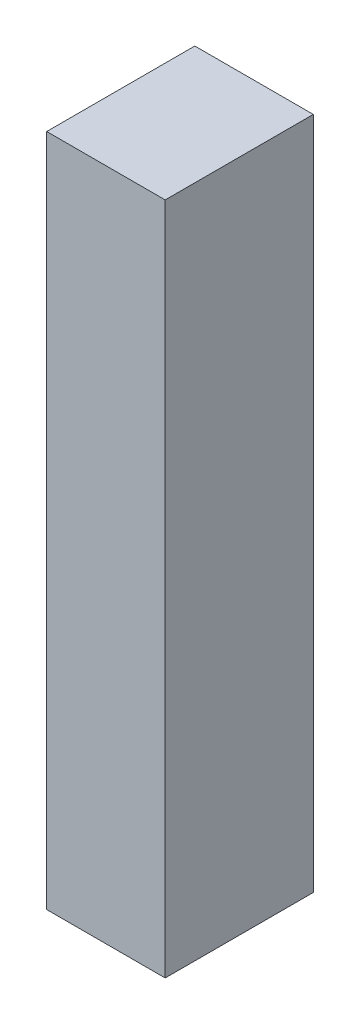
from build123d import *

# Parameters (mm, degrees)
SKETCH1_W           = 16
SKETCH1_H           = 91
BOSS_EXTRUDE1_DEPTH = 20


with BuildPart() as part:
    # Sketch1 → Boss-Extrude1 (new body)
    with BuildSketch(Plane.XY):
        Rectangle(SKETCH1_W, SKETCH1_H)
    extrude(amount=BOSS_EXTRUDE1_DEPTH)


solid = part.part
